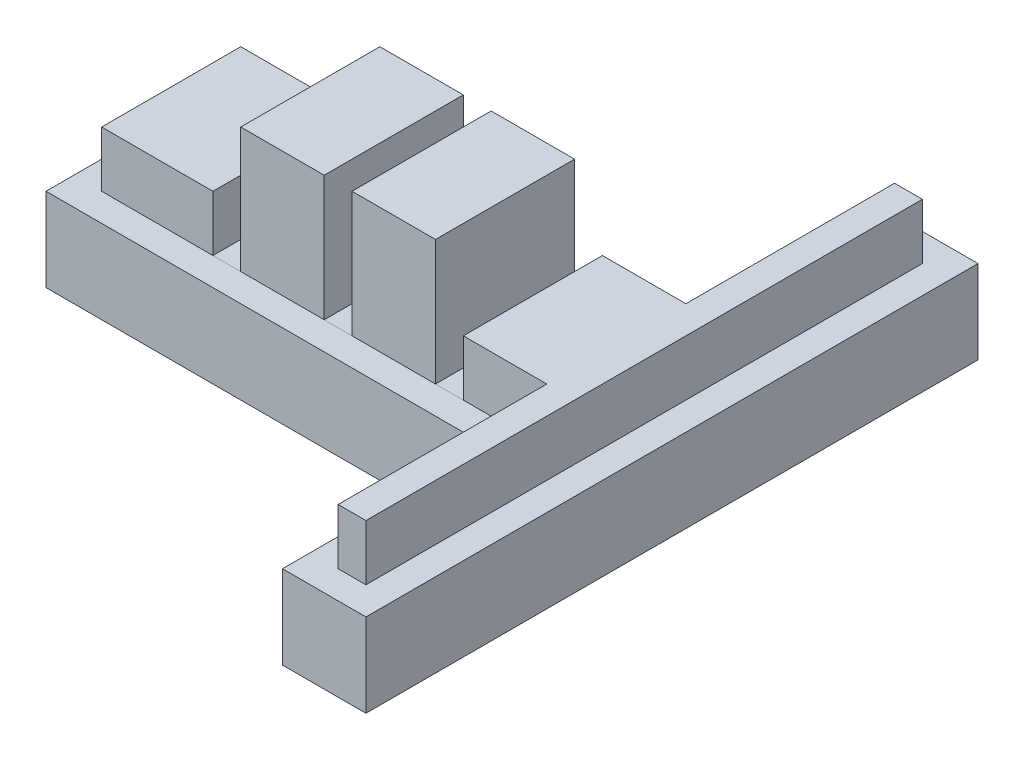
from build123d import *

# Parameters (mm, degrees)
SKETCH1_W            = 6
SKETCH1_H            = 10
BOSS_EXTRUDE1_DEPTH  = 13
SKETCH2_W            = 4
SKETCH2_H            = 6
CUT_EXTRUDE1_DEPTH   = 11
SKETCH3_W            = 10
SKETCH3_H            = 4
BOSS_EXTRUDE2_DEPTH  = 2
LPATTERN1_COUNT      = 2
LPATTERN1_PITCH      = 8
SKETCH18_W           = 10
SKETCH18_H           = 8
BOSS_EXTRUDE3_DEPTH  = 8
SKETCH20_W           = 10
SKETCH20_H           = 4
BOSS_EXTRUDE4_DEPTH  = 2
SKETCH21_W           = 10
SKETCH21_H           = 8
BOSS_EXTRUDE5_DEPTH  = 6
SKETCH22_W           = 40
SKETCH22_H           = 8
BOSS_EXTRUDE6_DEPTH  = 2
SKETCH23_W           = 4
SKETCH23_H           = 6
CUT_EXTRUDE2_DEPTH   = 6
BOSS_EXTRUDE15_DEPTH = 2
BOSS_EXTRUDE16_DEPTH = 6


with BuildPart() as part:
    # Sketch1 → Boss-Extrude1 (new body)
    with BuildSketch(Plane(origin=(0, 0, 0), x_dir=(1, 0, 0), z_dir=(0, 1, 0))):
        with Locations((3, 5)):
            Rectangle(SKETCH1_W, SKETCH1_H)
    extrude(amount=BOSS_EXTRUDE1_DEPTH)

    # Sketch2 → Cut-Extrude1 (cut)
    with BuildSketch(Plane.XZ):
        with Locations((3, -5)):
            Rectangle(SKETCH2_W, SKETCH2_H)
    extrude(amount=-CUT_EXTRUDE1_DEPTH, mode=Mode.SUBTRACT)

    # Sketch3 → Boss-Extrude2 (add)
    with BuildSketch(Plane.ZY):
        with Locations((-5, 2)):
            Rectangle(SKETCH3_W, SKETCH3_H)
    extrude(amount=BOSS_EXTRUDE2_DEPTH)


with BuildPart() as lpattern1_1:
    # LPattern1: pattern copy
    add(part.part.moved(Location(Vector(-1, 0, 0) * (1 * LPATTERN1_PITCH))))

    # Sketch18 → Boss-Extrude3 (add)
    with BuildSketch(Plane.ZY.offset(10)):
        with Locations((-5, 4)):
            Rectangle(SKETCH18_W, SKETCH18_H)
    extrude(amount=BOSS_EXTRUDE3_DEPTH)


with BuildPart() as part_1:
    add(part.part)

    # Sketch20 → Boss-Extrude4 (add)
    with BuildSketch(Plane(origin=(6, 0, 0), x_dir=(0, 0, -1), z_dir=(1, 0, 0))):
        with Locations((5, 2)):
            Rectangle(SKETCH20_W, SKETCH20_H)
    extrude(amount=BOSS_EXTRUDE4_DEPTH)

    # Sketch21 → Boss-Extrude5 (add)
    with BuildSketch(Plane(origin=(8, 0, 0), x_dir=(0, 0, -1), z_dir=(1, 0, 0))):
        with Locations((5, 4)):
            Rectangle(SKETCH21_W, SKETCH21_H)
    extrude(amount=BOSS_EXTRUDE5_DEPTH)

    # Sketch22 → Boss-Extrude6 (add)
    with BuildSketch(Plane(origin=(14, 0, 0), x_dir=(0, 0, -1), z_dir=(1, 0, 0))):
        with Locations((5, 4)):
            Rectangle(SKETCH22_W, SKETCH22_H)
    extrude(amount=BOSS_EXTRUDE6_DEPTH)


with BuildPart() as cut_extrude2_tool:
    # Sketch23 → Cut-Extrude2 (new body)
    with BuildSketch(Plane.XZ):
        with Locations((11, -5)):
            Rectangle(SKETCH23_W, SKETCH23_H)
        with Locations((-13, -5)):
            Rectangle(SKETCH23_W, SKETCH23_H)
    extrude(amount=-CUT_EXTRUDE2_DEPTH)


with BuildPart() as part_2:
    add(part_1.part)

    # Cut-Extrude2: cut by cut_extrude2_tool
    add(cut_extrude2_tool.part, mode=Mode.SUBTRACT)


with BuildPart() as lpattern1_1_1:
    add(lpattern1_1.part)

    # Cut-Extrude2: cut by cut_extrude2_tool
    add(cut_extrude2_tool.part, mode=Mode.SUBTRACT)

    # Combine1: union part
    add(part_2.part)


with BuildPart() as body_2:
    # Sketch33 → Boss-Extrude15 (new body)
    with BuildSketch(Plane.XZ):
        Polygon((14, 0), (-18, 0), (-18, -10), (14, -10), (14, -25), (16, -25), (16, 15), (14, 15), align=None)
    extrude(amount=BOSS_EXTRUDE15_DEPTH)

    # Sketch34 → Boss-Extrude16 (add)
    with BuildSketch(Plane.XZ.offset(2)):
        Polygon((12, 17), (12, 2), (-20, 2), (-20, -12), (12, -12), (12, -27), (18, -27), (18, 17), align=None)
        Polygon((14, 15), (14, 0), (-18, 0), (-18, -10), (14, -10), (14, -25), (16, -25), (16, 15), align=None, mode=Mode.SUBTRACT)
    extrude(amount=-BOSS_EXTRUDE16_DEPTH)


solid = Compound([lpattern1_1_1.part, body_2.part])
